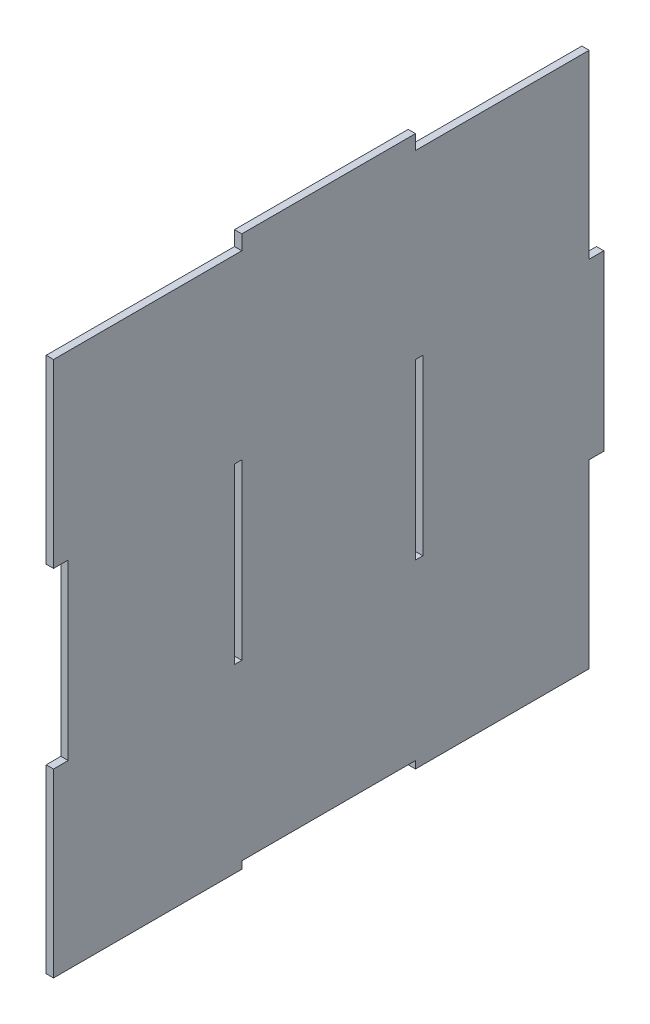
from build123d import *

# Parameters (mm, degrees)
SKETCH2_W           = 3.175
SKETCH2_H           = 75.333333334
BOSS_EXTRUDE1_DEPTH = 3.175
SKETCH3_W           = 3.175
SKETCH3_H           = 78.508333333
SKETCH3_W_2         = 75.333333334
SKETCH3_H_2         = 3.175
BOSS_EXTRUDE2_DEPTH = 3.175
SKETCH4_W           = 3.175
SKETCH4_H           = 78.508333333
CUT_EXTRUDE1_DEPTH  = 3.175


with BuildPart() as part:
    # Sketch2 → Boss-Extrude1 (new body)
    with BuildSketch(Plane(origin=(0, 0, 0), x_dir=(0, 0, -1), z_dir=(1, 0, 0))):
        Polygon((-113, 37.666666667), (-113, -37.666666667), (-116.175, -37.666666667), (-116.175, -116.175), (-37.666666667, -116.175), (-37.666666667, -113), (37.666666667, -113), (37.666666667, -116.175), (116.175, -116.175), (116.175, -37.666666667), (119.35, -37.666666667), (119.35, 37.666666667), (116.175, 37.666666667), (116.175, 116.175), (37.666666667, 116.175), (37.666666667, 119.35), (-37.666666667, 119.35), (-37.666666667, 116.175), (-116.175, 116.175), (-116.175, 37.666666667), align=None)
        with Locations((39.254166667, 0)):
            Rectangle(SKETCH2_W, SKETCH2_H, mode=Mode.SUBTRACT)
        with Locations((-39.254166667, 0)):
            Rectangle(SKETCH2_W, SKETCH2_H, mode=Mode.SUBTRACT)
    extrude(amount=BOSS_EXTRUDE1_DEPTH)

    # Sketch3 → Boss-Extrude2 (add)
    with BuildSketch(Plane(origin=(3.175, 0, 0), x_dir=(0, 0, -1), z_dir=(1, 0, 0))):
        with Locations((-117.7625, 76.920833334)):
            Rectangle(SKETCH3_W, SKETCH3_H)
        with Locations((-117.7625, -76.920833334)):
            Rectangle(SKETCH3_W, SKETCH3_H)
        with Locations((0, 120.9375)):
            Rectangle(SKETCH3_W_2, SKETCH3_H_2)
    extrude(amount=-BOSS_EXTRUDE2_DEPTH)

    # Sketch4 → Cut-Extrude1 (cut)
    with BuildSketch(Plane(origin=(3.175, 0, 0), x_dir=(0, 0, -1), z_dir=(1, 0, 0))):
        with Locations((114.5875, 76.920833334)):
            Rectangle(SKETCH4_W, SKETCH4_H)
        with Locations((114.5875, -76.920833334)):
            Rectangle(SKETCH4_W, SKETCH4_H)
    extrude(amount=-CUT_EXTRUDE1_DEPTH, mode=Mode.SUBTRACT)


solid = part.part
